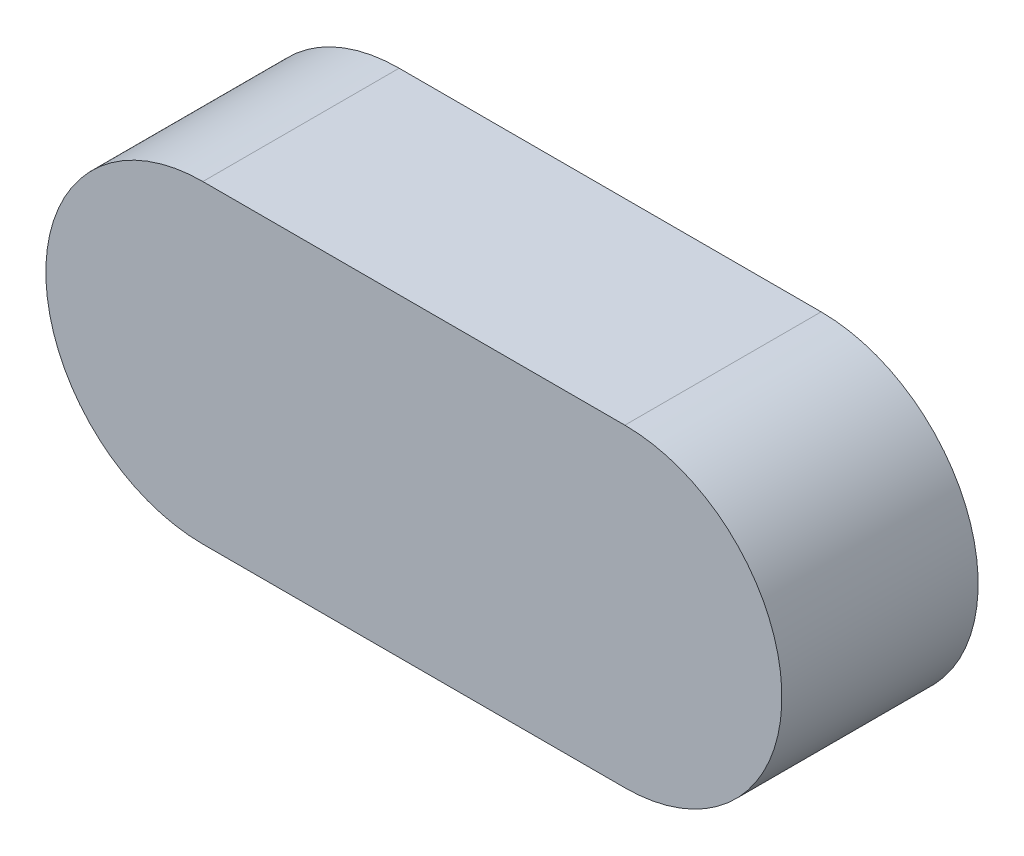
from build123d import *

# Parameters (mm, degrees)
EXTRUDE_1_DEPTH = 20


with BuildPart() as part:
    # 草图1 → 拉伸1 (new body)
    with BuildSketch(Plane.XY):
        with BuildLine():
            Line((-21.5, 16), (21.5, 16))
            ThreePointArc((21.5, 16), (37.5, 0), (21.5, -16))
            Line((21.5, -16), (-21.5, -16))
            ThreePointArc((-21.5, -16), (-37.5, 0), (-21.5, 16))
        make_face()
    extrude(amount=EXTRUDE_1_DEPTH)


solid = part.part
